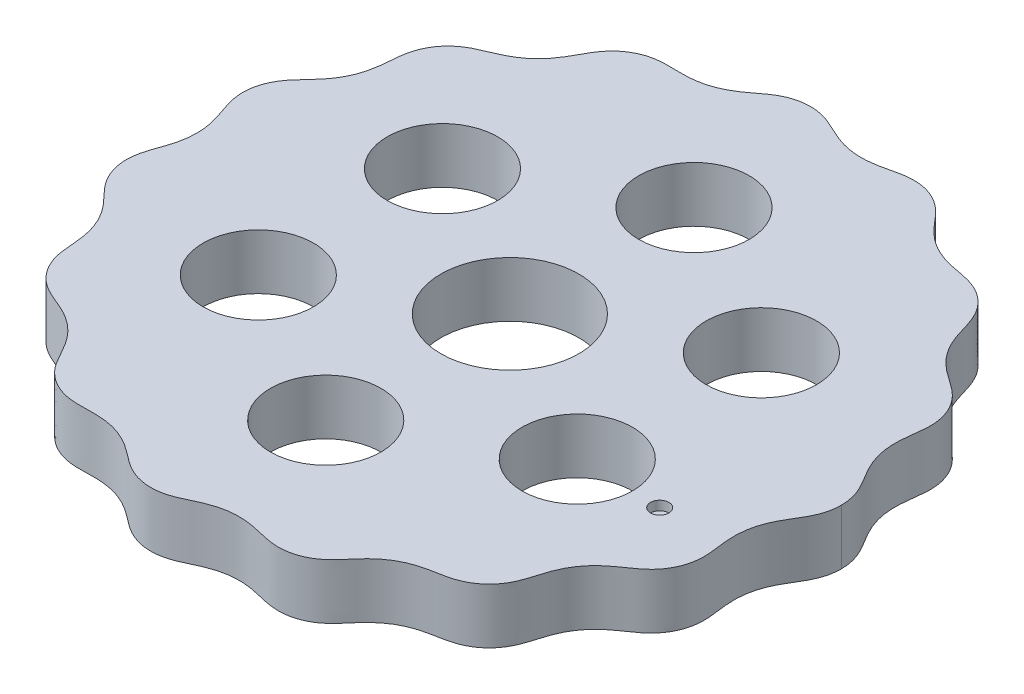
from build123d import *

# Parameters (mm, degrees)
BOSS_EXTRUDE1_DEPTH = 6
SKETCH4_R           = 7.5
SKETCH4_R_2         = 6
CUT_EXTRUDE1_DEPTH  = 52.384193919
SKETCH5_R           = 1
CUT_EXTRUDE2_DEPTH  = 1


with BuildPart() as part:
    # Sketch3 → Boss-Extrude1 (new body)
    with BuildSketch(Plane(origin=(0, 0, 0), x_dir=(1, 0, 0), z_dir=(0, 1, 0))):
        with BuildLine():
            add(Edge.make_bspline(
                [(-35, 0), (-35, -0.035819522), (-35.000616373, -0.107462841), (-35.003390054, -0.256808001), (-35.01077535, -0.421646413), (-35.021825769, -0.588219856), (-35.036504882, -0.756672424), (-35.059341773, -0.965837166), (-35.104035951, -1.290553755), (-35.185204177, -1.728353622), (-35.321111932, -2.274340703), (-35.511398877, -2.882930915), (-35.744117036, -3.541888991), (-35.999231193, -4.25800942), (-36.256031973, -5.161379022), (-36.390330129, -6.274752326), (-36.277015947, -7.512136969), (-35.868698722, -8.695231313), (-35.277300884, -9.669426211), (-34.554347705, -10.519941998), (-33.783626013, -11.298902855), (-32.985846748, -12.201646947), (-32.264584631, -13.30297659), (-31.737724515, -14.528623762), (-31.426244596, -15.845428611), (-31.299137645, -17.27258243), (-31.216127, -18.70530298), (-30.816120234, -20.100603953), (-30.073240875, -21.341751418), (-29.174351138, -22.250438515), (-28.172415899, -22.896093055), (-27.127590318, -23.355931746), (-26.10859664, -23.758738206), (-25.049780962, -24.277964858), (-23.989709649, -24.997868072), (-23.038745697, -25.922173331), (-22.234852767, -27.03288543), (-21.57001817, -28.281907032), (-20.900127092, -29.513378936), (-19.962466181, -30.574068753), (-18.795181919, -31.366318649), (-17.595631263, -31.810691732), (-16.414666993, -31.974330851), (-15.281171148, -31.958959306), (-14.203514384, -31.91747762), (-13.042151806, -31.968001953), (-11.783279681, -32.201214224), (-10.531309832, -32.66971044), (-9.48395263, -33.292502605), (-8.648334169, -33.920550223), (-7.823957174, -34.560196788), (-6.963270269, -35.155080008), (-5.844676613, -35.655024643), (-4.471519425, -35.893755086), (-3.187084678, -35.805499477), (-2.025952576, -35.461710054), (-0.992256939, -34.976213141), (-0.022683462, -34.502923006), (1.053080375, -34.087641485), (2.299584809, -33.794526859), (3.643320491, -33.722351619), (5.038534255, -33.89893647), (6.24598376, -34.2125404), (7.264354515, -34.444119372), (8.305207807, -34.543324073), (9.35208771, -34.482213909), (10.516758731, -34.167289325), (11.659268337, -33.537177777), (12.590715473, -32.709121516), (13.34098787, -31.814858509), (14.054283468, -30.982389039), (14.885038409, -30.182951686), (15.921872801, -29.431794231), (16.990420846, -28.917750141), (18.026343297, -28.602305782), (18.918007091, -28.413618025), (19.578784746, -28.293993849), (20.403759493, -28.135463838), (21.377672688, -27.861653344), (22.443971731, -27.335099919), (23.483734656, -26.460176512), (24.2541157, -25.405895772), (24.750574375, -24.262578026), (25.063904971, -23.146552345), (25.378639074, -22.114017621), (25.813131886, -21.064921211), (26.460434486, -19.960662125), (27.343829971, -18.932625358), (28.322904319, -18.143559056), (29.218225657, -17.541804862), (30.028748291, -16.97273782), (30.797058719, -16.328598531), (31.549909645, -15.413617977), (32.137977425, -14.188738612), (32.4089126, -12.90202686), (32.388985538, -11.637704019), (32.213594686, -10.474436855), (32.085323796, -9.385180269), (32.070146733, -8.410557002), (32.151917663, -7.56387468), (32.314560623, -6.756019588), (32.548800101, -5.992599911), (32.857935391, -5.266485518), (33.224571124, -4.579437291), (33.588738685, -3.973485748), (33.923596212, -3.433268023), (34.247631958, -2.87530324), (34.535248612, -2.28660009), (34.721954293, -1.781365153), (34.833464319, -1.375289499), (34.894669525, -1.087159539), (34.924762046, -0.921603412), (34.949915122, -0.755248907), (34.967564963, -0.608302523), (34.979558938, -0.483828007), (34.987456793, -0.380154151), (34.992514334, -0.294893351), (34.997257891, -0.183172559), (34.999367206, -0.089514524), (35, -0.035799586), (35, 0)],
                knots=[0.072369566, 0.072369566, 0.072369566, 0.072369566, 0.072369566, 0.073615092, 0.074860618, 0.076106145, 0.077351671, 0.078597197, 0.079842723, 0.082333775, 0.087048504, 0.091763233, 0.096477961, 0.10119269, 0.107724794, 0.114256899, 0.124215283, 0.134174364, 0.144132897, 0.150929746, 0.157726596, 0.167142542, 0.176558488, 0.186520945, 0.196481925, 0.206428247, 0.21637457, 0.228908069, 0.238866866, 0.248825964, 0.258784129, 0.266347185, 0.273910241, 0.282559119, 0.291207998, 0.301173216, 0.311644672, 0.321600071, 0.33155547, 0.343058906, 0.353017844, 0.362977018, 0.372934936, 0.380512964, 0.388090993, 0.396475019, 0.404859045, 0.41482336, 0.425823506, 0.435780105, 0.440758404, 0.445736704, 0.456709828, 0.4666684, 0.476627191, 0.48658549, 0.494428383, 0.502271277, 0.510390705, 0.518510134, 0.528474739, 0.540002591, 0.549960093, 0.559917595, 0.565389224, 0.570860853, 0.580819423, 0.590778216, 0.600736338, 0.609094586, 0.617452834, 0.625307542, 0.633162249, 0.643125841, 0.655188139, 0.660154677, 0.665121215, 0.670087753, 0.675054292, 0.685012018, 0.694970449, 0.704929277, 0.714887192, 0.723259667, 0.731632143, 0.739222078, 0.746812013, 0.756777196, 0.769365725, 0.779035556, 0.783870472, 0.788705388, 0.798661668, 0.808620831, 0.818580086, 0.828537566, 0.837174689, 0.845811813, 0.853388632, 0.860965452, 0.865947313, 0.870929173, 0.87773944, 0.884549706, 0.889251298, 0.893952891, 0.898654484, 0.903356076, 0.908334949, 0.913313821, 0.914558654, 0.915803487, 0.91704832, 0.918293153, 0.919537985, 0.920160402, 0.920782818, 0.921405235, 0.922027651, 0.923272484, 0.923272484, 0.923272484, 0.923272484, 0.923272484], degree=4))
            add(Edge.make_bspline(
                [(-35, 0), (-35, 0.035819522), (-35.000616373, 0.107462841), (-35.003390054, 0.256808001), (-35.01077535, 0.421646413), (-35.021825769, 0.588219856), (-35.036504882, 0.756672424), (-35.059341773, 0.965837166), (-35.104035951, 1.290553755), (-35.185204177, 1.728353622), (-35.321111932, 2.274340703), (-35.511398877, 2.882930915), (-35.744117036, 3.541888991), (-35.999231193, 4.25800942), (-36.256031973, 5.161379022), (-36.390330129, 6.274752326), (-36.277015947, 7.512136969), (-35.868698722, 8.695231313), (-35.277300884, 9.669426211), (-34.554347705, 10.519941998), (-33.783626013, 11.298902855), (-32.985846748, 12.201646947), (-32.264584631, 13.30297659), (-31.737724515, 14.528623762), (-31.426244596, 15.845428611), (-31.299137645, 17.27258243), (-31.216127, 18.70530298), (-30.816120234, 20.100603953), (-30.073240875, 21.341751418), (-29.174351138, 22.250438515), (-28.172415899, 22.896093055), (-27.127590318, 23.355931746), (-26.10859664, 23.758738206), (-25.049780962, 24.277964858), (-23.989709649, 24.997868072), (-23.038745697, 25.922173331), (-22.234852767, 27.03288543), (-21.57001817, 28.281907032), (-20.900127092, 29.513378936), (-19.962466181, 30.574068753), (-18.795181919, 31.366318649), (-17.595631263, 31.810691732), (-16.414666993, 31.974330851), (-15.281171148, 31.958959306), (-14.203514384, 31.91747762), (-13.042151806, 31.968001953), (-11.783279681, 32.201214224), (-10.531309831, 32.66971044), (-9.48395263, 33.292502605), (-8.648334169, 33.920550223), (-7.823957174, 34.560196788), (-6.963270269, 35.155080008), (-5.844676613, 35.655024643), (-4.471519425, 35.893755086), (-3.187084678, 35.805499476), (-2.025952576, 35.461710054), (-0.992256939, 34.976213141), (-0.022683462, 34.502923006), (1.053080375, 34.087641485), (2.299584809, 33.794526859), (3.643320491, 33.722351618), (5.038534255, 33.89893647), (6.24598376, 34.2125404), (7.264354515, 34.444119372), (8.305207807, 34.543324073), (9.35208771, 34.482213909), (10.516758731, 34.167289325), (11.659268337, 33.537177777), (12.590715473, 32.709121516), (13.34098787, 31.814858509), (14.054283468, 30.982389039), (14.885038409, 30.182951686), (15.921872801, 29.431794231), (16.990420846, 28.917750141), (18.026343297, 28.602305782), (18.918007091, 28.413618025), (19.578784746, 28.293993848), (20.403759493, 28.135463838), (21.377672688, 27.861653344), (22.443971731, 27.335099919), (23.483734656, 26.460176512), (24.2541157, 25.405895772), (24.750574375, 24.262578026), (25.063904971, 23.146552345), (25.378639074, 22.114017621), (25.813131886, 21.064921211), (26.460434486, 19.960662125), (27.343829971, 18.932625358), (28.322904319, 18.143559056), (29.218225657, 17.541804862), (30.028748291, 16.97273782), (30.797058719, 16.328598531), (31.549909645, 15.413617977), (32.137977425, 14.188738612), (32.4089126, 12.90202686), (32.388985538, 11.637704019), (32.213594686, 10.474436855), (32.085323796, 9.385180269), (32.070146733, 8.410557002), (32.151917663, 7.56387468), (32.314560623, 6.756019588), (32.548800101, 5.992599911), (32.857935391, 5.266485518), (33.224571124, 4.579437291), (33.588738685, 3.973485748), (33.923596212, 3.433268023), (34.247631958, 2.87530324), (34.535248612, 2.28660009), (34.721954293, 1.781365153), (34.833464319, 1.375289499), (34.894669525, 1.087159539), (34.924762046, 0.921603411), (34.949915122, 0.755248907), (34.967564963, 0.608302523), (34.979558938, 0.483828007), (34.987456793, 0.380154151), (34.992514334, 0.294893351), (34.997257891, 0.183172559), (34.999367206, 0.089514524), (35, 0.035799586), (35, 0)],
                knots=[0.072369566, 0.072369566, 0.072369566, 0.072369566, 0.072369566, 0.073615092, 0.074860618, 0.076106145, 0.077351671, 0.078597197, 0.079842723, 0.082333775, 0.087048504, 0.091763233, 0.096477961, 0.10119269, 0.107724794, 0.114256899, 0.124215283, 0.134174364, 0.144132897, 0.150929746, 0.157726596, 0.167142542, 0.176558488, 0.186520945, 0.196481925, 0.206428247, 0.21637457, 0.228908069, 0.238866866, 0.248825964, 0.258784129, 0.266347185, 0.273910241, 0.282559119, 0.291207998, 0.301173216, 0.311644672, 0.321600071, 0.33155547, 0.343058906, 0.353017844, 0.362977018, 0.372934936, 0.380512964, 0.388090993, 0.396475019, 0.404859045, 0.41482336, 0.425823506, 0.435780105, 0.440758404, 0.445736704, 0.456709828, 0.4666684, 0.476627191, 0.48658549, 0.494428383, 0.502271277, 0.510390705, 0.518510134, 0.528474739, 0.540002591, 0.549960093, 0.559917595, 0.565389224, 0.570860853, 0.580819423, 0.590778216, 0.600736338, 0.609094586, 0.617452834, 0.625307542, 0.633162249, 0.643125841, 0.655188139, 0.660154677, 0.665121215, 0.670087753, 0.675054292, 0.685012018, 0.694970449, 0.704929277, 0.714887192, 0.723259667, 0.731632143, 0.739222078, 0.746812013, 0.756777196, 0.769365725, 0.779035556, 0.783870472, 0.788705388, 0.798661668, 0.808620831, 0.818580086, 0.828537566, 0.837174689, 0.845811813, 0.853388632, 0.860965452, 0.865947313, 0.870929173, 0.87773944, 0.884549706, 0.889251298, 0.893952891, 0.898654484, 0.903356076, 0.908334949, 0.913313821, 0.914558654, 0.915803487, 0.91704832, 0.918293153, 0.919537985, 0.920160402, 0.920782818, 0.921405235, 0.922027651, 0.923272484, 0.923272484, 0.923272484, 0.923272484, 0.923272484], degree=4))
        make_face()
    extrude(amount=BOSS_EXTRUDE1_DEPTH)

    # Sketch4 → Cut-Extrude1 (cut, through all)
    with BuildSketch(Plane(origin=(0, 6, 0), x_dir=(1, 0, 0), z_dir=(0, 1, 0))):
        with Locations(Location((-1, 0, 0), (0, 0, 270))):
            Circle(SKETCH4_R)
        with Locations(Location((-1, 20, 0), (0, 0, 270))):
            Circle(SKETCH4_R_2)
        with Locations(Location((16.320508076, 10, 0), (0, 0, 270))):
            Circle(SKETCH4_R_2)
        with Locations(Location((16.320508076, -10, 0), (0, 0, 270))):
            Circle(SKETCH4_R_2)
        with Locations(Location((-1, -20, 0), (0, 0, 270))):
            Circle(SKETCH4_R_2)
        with Locations(Location((-18.320508076, -10, 0), (0, 0, 270))):
            Circle(SKETCH4_R_2)
        with Locations(Location((-18.320508076, 10, 0), (0, 0, 270))):
            Circle(SKETCH4_R_2)
    extrude(amount=-CUT_EXTRUDE1_DEPTH, mode=Mode.SUBTRACT)

    # Sketch5 → Cut-Extrude2 (cut)
    with BuildSketch(Plane(origin=(0, 6, 0), x_dir=(1, 0, 0), z_dir=(0, 1, 0))):
        with Locations(Location((25.37148754, -10.092390774, 0), (0, 0, 270))):
            Circle(SKETCH5_R)
    extrude(amount=-CUT_EXTRUDE2_DEPTH, mode=Mode.SUBTRACT)


solid = part.part
